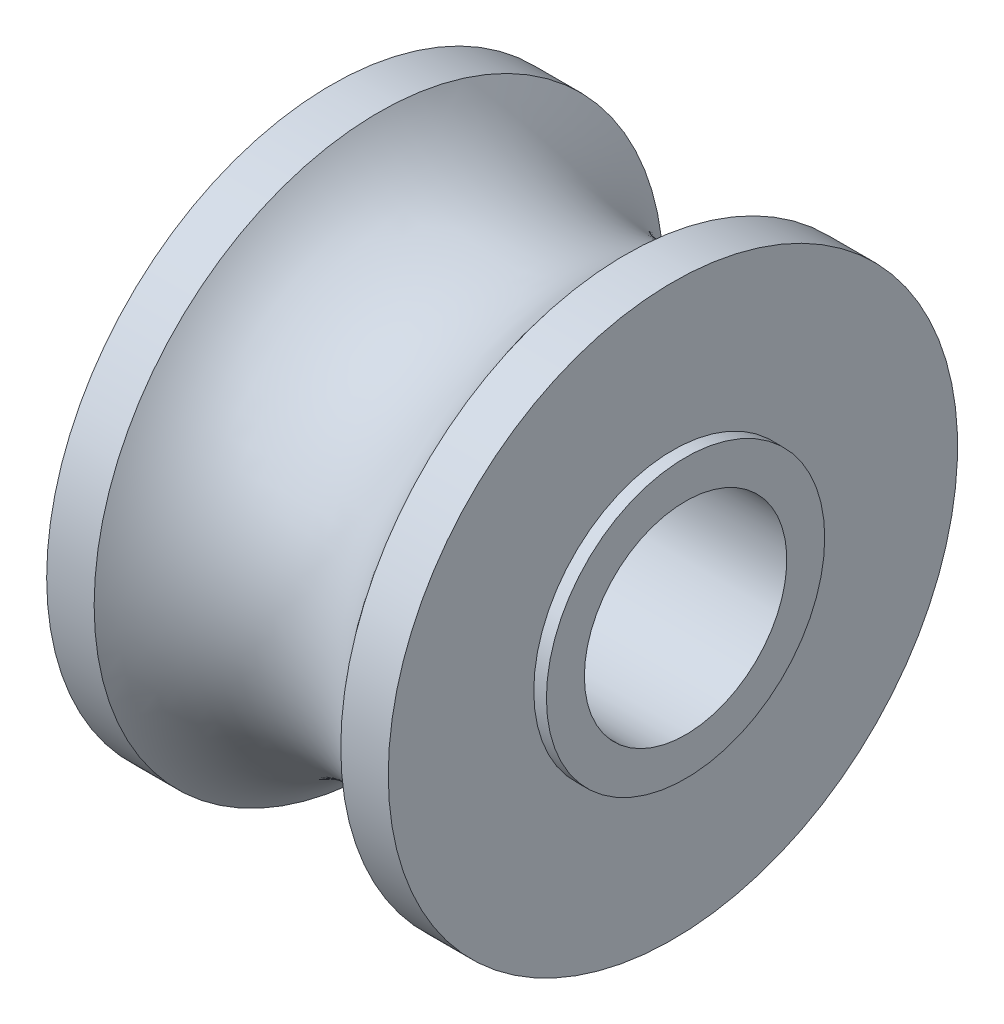
from build123d import *


with BuildPart() as part:
    # Sketch1 → Revolve1 (revolve)
    with BuildSketch(Plane.XY, mode=Mode.PRIVATE) as revolve1_sk:
        with BuildLine():
            ThreePointArc((-4.873397172, 11.25), (0, 8.75), (4.873397172, 11.25))
            Line((4.873397172, 11.25), (6.75, 11.25))
            Line((6.75, 11.25), (6.75, 5.5))
            Line((6.75, 5.5), (7.25, 5.5))
            Line((7.25, 5.5), (7.25, 4))
            Line((7.25, 4), (-7.25, 4))
            Line((-7.25, 4), (-7.25, 5.5))
            Line((-7.25, 5.5), (-6.75, 5.5))
            Line((-6.75, 5.5), (-6.75, 11.25))
            Line((-6.75, 11.25), (-4.873397172, 11.25))
        make_face()
    revolve(revolve1_sk.sketch.rotate(Axis((-7.25, 0, 0), (1, 0, 0)), 90), axis=Axis((-7.25, 0, 0), (1, 0, 0)))


solid = part.part
